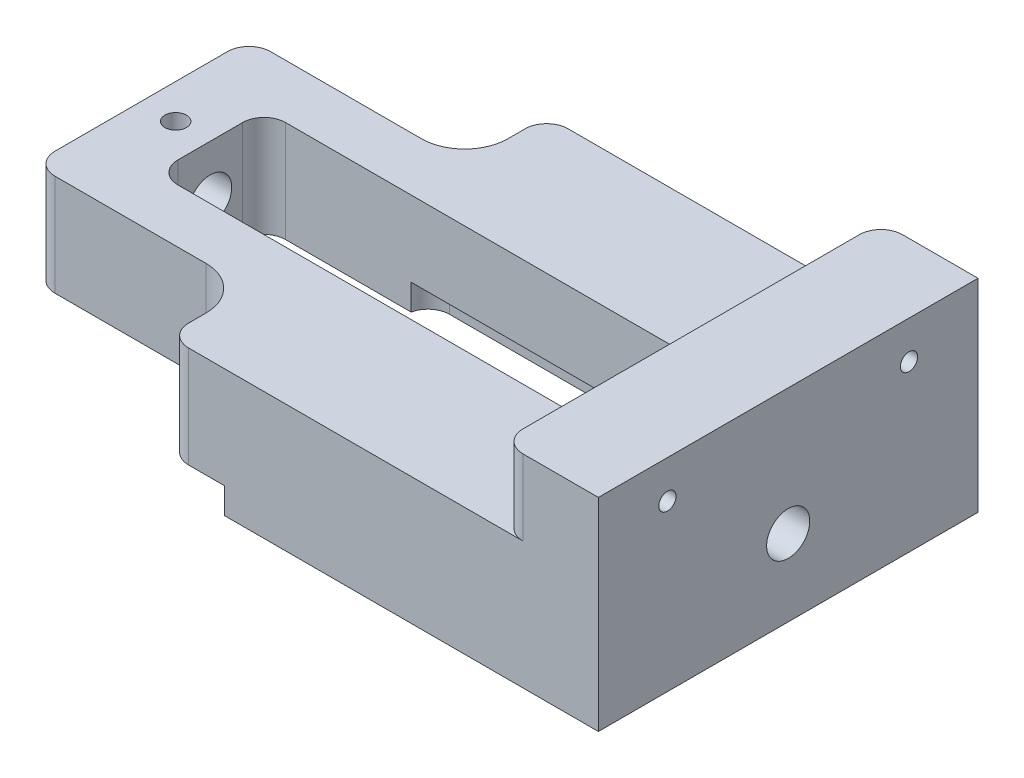
from build123d import *

# Parameters (mm, degrees)
BOSS_EXTRUDE1_DEPTH = 47
BOSS_EXTRUDE2_DEPTH = 35
BOSS_EXTRUDE3_START = 12
BOSS_EXTRUDE3_DEPTH = 12
SKETCH3_R           = 4
CUT_EXTRUDE1_DEPTH  = 324.215098657
SKETCH6_R           = 7.5
CUT_EXTRUDE3_DEPTH  = 12
CUT_EXTRUDE2_DEPTH  = 12
SKETCH8_R           = 5
CUT_EXTRUDE4_DEPTH  = 14


with BuildPart() as part:
    # Sketch1 → Boss-Extrude1 (new body)
    with BuildSketch(Plane(origin=(0, 0, 0), x_dir=(1, 0, 0), z_dir=(0, 1, 0))):
        with BuildLine():
            Line((-256.288485132, 40), (-256.288485132, -40))
            ThreePointArc((-256.288485132, -40), (-253.359552944, -47.071067812), (-246.288485132, -50))
            Line((-246.288485132, -50), (-176.288485132, -50))
            ThreePointArc((-176.288485132, -50), (-162.146349509, -55.857864376), (-156.288485132, -70))
            Line((-156.288485132, -70), (-156.288485132, -78))
            ThreePointArc((-156.288485132, -78), (-153.359552944, -85.071067812), (-146.288485132, -88))
            Line((-146.288485132, -88), (43.711514868, -88))
            Line((43.711514868, -88), (43.711514868, 88))
            Line((43.711514868, 88), (-146.288485132, 88))
            ThreePointArc((-146.288485132, 88), (-153.359552944, 85.071067812), (-156.288485132, 78))
            Line((-156.288485132, 78), (-156.288485132, 70))
            ThreePointArc((-156.288485132, 70), (-162.146349509, 55.857864376), (-176.288485132, 50))
            Line((-176.288485132, 50), (-246.288485132, 50))
            ThreePointArc((-246.288485132, 50), (-253.359552944, 47.071067812), (-256.288485132, 40))
        make_face()
        with BuildLine():
            Line((-224.288485132, 15), (-224.288485132, -15))
            ThreePointArc((-224.288485132, -15), (-221.359552944, -22.071067812), (-214.288485132, -25))
            Line((-214.288485132, -25), (-9.288485132, -25))
            ThreePointArc((-9.288485132, -25), (-2.217417321, -22.071067812), (0.711514868, -15))
            Line((0.711514868, -15), (0.711514868, 15))
            ThreePointArc((0.711514868, 15), (-2.217417321, 22.071067812), (-9.288485132, 25))
            Line((-9.288485132, 25), (-214.288485132, 25))
            ThreePointArc((-214.288485132, 25), (-221.359552944, 22.071067812), (-224.288485132, 15))
        make_face(mode=Mode.SUBTRACT)
    extrude(amount=BOSS_EXTRUDE1_DEPTH)

    # Sketch2 → Boss-Extrude2 (add)
    with BuildSketch(Plane(origin=(0, 47, 0), x_dir=(1, 0, 0), z_dir=(0, 1, 0))):
        with BuildLine():
            Line((43.711514868, -88), (43.711514868, 88))
            Line((43.711514868, 88), (8.711514868, 88))
            ThreePointArc((8.711514868, 88), (1.640447056, 85.071067812), (-1.288485132, 78))
            Line((-1.288485132, 78), (-1.288485132, -78))
            ThreePointArc((-1.288485132, -78), (1.640447056, -85.071067812), (8.711514868, -88))
            Line((8.711514868, -88), (43.711514868, -88))
        make_face()
    extrude(amount=BOSS_EXTRUDE2_DEPTH)

    # Sketch7 → Boss-Extrude3 (add)
    with BuildSketch(Plane.XZ.offset(BOSS_EXTRUDE3_START)):
        with BuildLine():
            ThreePointArc((-1.288485132, -61.905249807), (-72.230589483, -41.6045326), (-129.609696252, -88))
            Line((-129.609696252, -88), (43.711514868, -88))
            Line((43.711514868, -88), (43.711514868, 88))
            Line((43.711514868, 88), (-129.609696252, 88))
            ThreePointArc((-129.609696252, 88), (-72.230589483, 41.6045326), (-1.288485132, 61.905249807))
            Line((-1.288485132, 61.905249807), (-1.288485132, 21))
            ThreePointArc((-1.288485132, 21), (0.198347848, 18.16227766), (0.711514868, 15))
            Line((0.711514868, 15), (0.711514868, -15))
            ThreePointArc((0.711514868, -15), (0.198347848, -18.16227766), (-1.288485132, -21))
            Line((-1.288485132, -21), (-1.288485132, -61.905249807))
        make_face()
    extrude(amount=-BOSS_EXTRUDE3_DEPTH)

    # Sketch3 → Cut-Extrude1 (cut, through all)
    with BuildSketch(Plane.ZY.offset(256.288485132)):
        with BuildLine():
            ThreePointArc((0, 33.5), (-10, 23.5), (0, 13.5))
            Line((0, 13.5), (0, 33.5))
        make_face()
        with BuildLine():
            Line((0, 33.5), (0, 13.5))
            ThreePointArc((0, 13.5), (7.071067812, 16.428932188), (10, 23.5))
            ThreePointArc((10, 23.5), (7.071067812, 30.571067812), (0, 33.5))
        make_face()
        with Locations((56, 64.5)):
            Circle(SKETCH3_R)
        with Locations((-56, 64.5)):
            Circle(SKETCH3_R)
    extrude(amount=-CUT_EXTRUDE1_DEPTH, mode=Mode.SUBTRACT)

    # Sketch6 → Cut-Extrude3 (cut)
    with BuildSketch(Plane.XZ):
        with Locations(Location((-56.288485132, 65, 0), (0, 0, 270))):
            Circle(SKETCH6_R)
        with Locations(Location((-56.288485132, -65, 0), (0, 0, 270))):
            Circle(SKETCH6_R)
    extrude(amount=CUT_EXTRUDE3_DEPTH, mode=Mode.SUBTRACT)

    # Sketch5 → Cut-Extrude2 (cut)
    with BuildSketch(Plane.XZ):
        with BuildLine():
            Line((0, 23), (0, -23))
            ThreePointArc((0, -23), (-2.928932188, -30.071067812), (-10, -33))
            Line((-10, -33), (-146.288485132, -33))
            ThreePointArc((-146.288485132, -33), (-153.359552944, -30.071067812), (-156.288485132, -23))
            Line((-156.288485132, -23), (-156.288485132, 23))
            ThreePointArc((-156.288485132, 23), (-153.359552944, 30.071067812), (-146.288485132, 33))
            Line((-146.288485132, 33), (-10, 33))
            ThreePointArc((-10, 33), (-2.928932188, 30.071067812), (0, 23))
        make_face()
    extrude(amount=-CUT_EXTRUDE2_DEPTH, mode=Mode.SUBTRACT)

    # Sketch8 → Cut-Extrude4 (cut)
    with BuildSketch(Plane(origin=(0, 47, 0), x_dir=(1, 0, 0), z_dir=(0, 1, 0))):
        with Locations(Location((-240.288485132, 0, 0), (0, 0, 270))):
            Circle(SKETCH8_R)
    extrude(amount=-CUT_EXTRUDE4_DEPTH, mode=Mode.SUBTRACT)


solid = part.part
